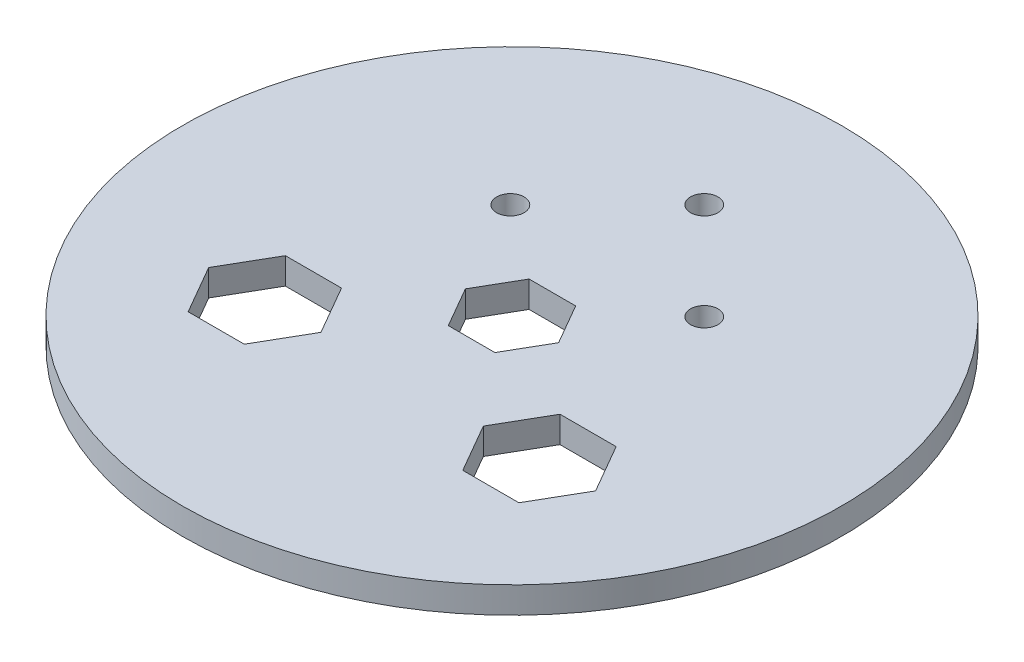
from build123d import *

# Parameters (mm, degrees)
SKETCH1_R           = 60
BOSS_EXTRUDE1_DEPTH = 2.4
SKETCH2_R           = 2.5
CUT_EXTRUDE1_DEPTH  = 85.988469806


with BuildPart() as part:
    # Sketch1 → Boss-Extrude1 (new, symmetric)
    with BuildSketch(Plane(origin=(0, 0, 0), x_dir=(1, 0, 0), z_dir=(0, 1, 0))):
        with Locations(Location((0, 0, 0), (0, 0, 270))):
            Circle(SKETCH1_R)
        Polygon((8.487048957, 0), (4.243524479, 7.35), (-4.243524479, 7.35), (-8.487048957, 0), (-4.243524479, -7.35), (4.243524479, -7.35), align=None, mode=Mode.SUBTRACT)
        Polygon((-14.780900235, -20), (-19.890450118, -11.15), (-30.109549882, -11.15), (-35.219099765, -20), (-30.109549882, -28.85), (-19.890450118, -28.85), align=None, mode=Mode.SUBTRACT)
        Polygon((35.219099765, -20), (30.109549882, -11.15), (19.890450118, -11.15), (14.780900235, -20), (19.890450118, -28.85), (30.109549882, -28.85), align=None, mode=Mode.SUBTRACT)
    extrude(amount=BOSS_EXTRUDE1_DEPTH, both=True)

    # Sketch2 → Cut-Extrude1 (cut, through all)
    with BuildSketch(Plane(origin=(0, 2.4, 0), x_dir=(1, 0, 0), z_dir=(0, 1, 0))):
        with Locations(Location((0, 35, 0), (0, 0, 270))):
            Circle(SKETCH2_R)
        with Locations(Location((17.65, 17.35, 0), (0, 0, 270))):
            Circle(SKETCH2_R)
        with Locations(Location((-17.65, 17.35, 0), (0, 0, 270))):
            Circle(SKETCH2_R)
    extrude(amount=-CUT_EXTRUDE1_DEPTH, mode=Mode.SUBTRACT)


solid = part.part
